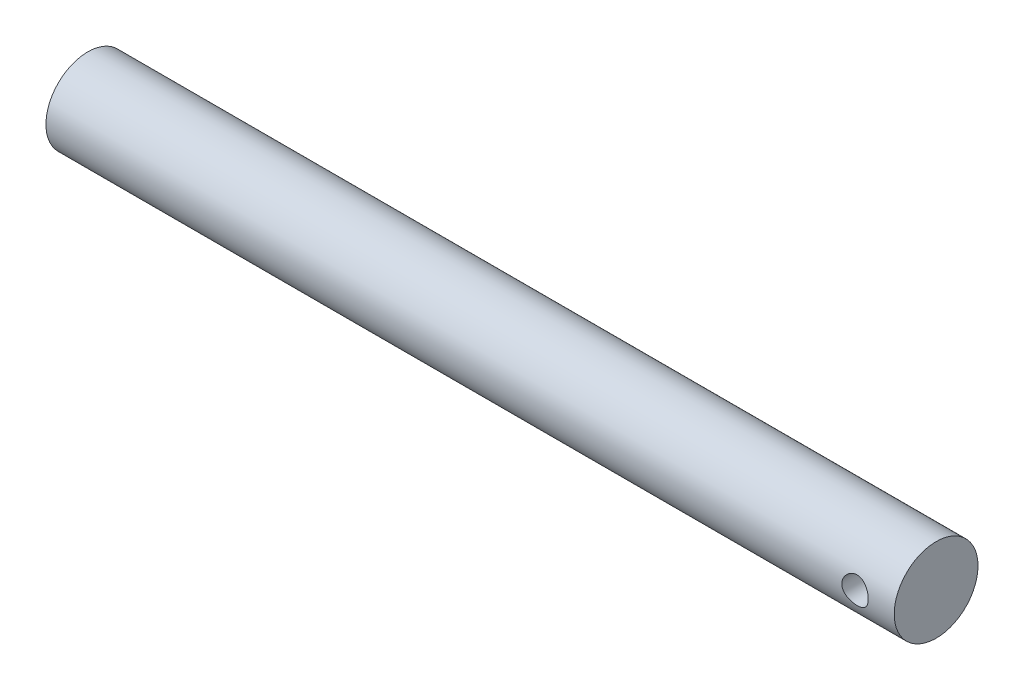
from build123d import *

# Parameters (mm, degrees)
SKETCH1_R           = 10.033
BOSS_EXTRUDE1_DEPTH = 203.2
SKETCH2_R           = 3.175
CUT_EXTRUDE1_DEPTH  = 12.7


with BuildPart() as part:
    # Sketch1 → Boss-Extrude1 (new body)
    with BuildSketch(Plane(origin=(0, 0, 0), x_dir=(0, 0, -1), z_dir=(1, 0, 0))):
        Circle(SKETCH1_R)
    extrude(amount=BOSS_EXTRUDE1_DEPTH)

    # Sketch2 → Cut-Extrude1 (cut, symmetric)
    with BuildSketch(Plane.XY):
        with Locations((193.802, 0)):
            Circle(SKETCH2_R)
    extrude(amount=CUT_EXTRUDE1_DEPTH, both=True, mode=Mode.SUBTRACT)


solid = part.part
